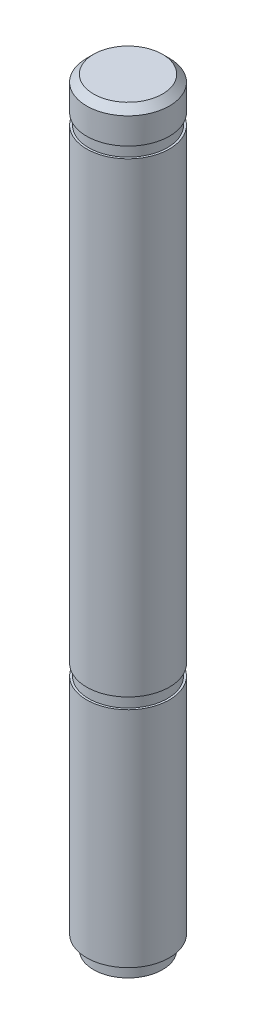
from build123d import *

# Parameters (mm, degrees)
SKETCH1_R           = 3
BOSS_EXTRUDE1_DEPTH = 40
CUT_EXTRUDE1_START  = 3.2
SKETCH2_R           = 3
SKETCH2_R_2         = 2.85
CUT_EXTRUDE1_DEPTH  = 0.8
CUT_EXTRUDE2_START  = -2.2
SKETCH3_R           = 3
SKETCH3_R_2         = 2.85
CUT_EXTRUDE2_DEPTH  = 0.8
CHAMFER1_SIZE       = 0.5
BOSS_EXTRUDE2_START = 15
SKETCH4_R           = 3
BOSS_EXTRUDE2_DEPTH = 15
SKETCH5_R           = 3
SKETCH5_R_2         = 2.5
CUT_EXTRUDE3_DEPTH  = 1


with BuildPart() as part:
    # Sketch1 → Boss-Extrude1 (new body)
    with BuildSketch(Plane(origin=(0, 0, 0), x_dir=(1, 0, 0), z_dir=(0, 1, 0))):
        with Locations(Location((0, 0, 0), (0, 0, 270))):
            Circle(SKETCH1_R)
    extrude(amount=BOSS_EXTRUDE1_DEPTH)

    # Sketch2 → Cut-Extrude1 (cut)
    with BuildSketch(Plane.XZ.offset(-40).offset(CUT_EXTRUDE1_START)):
        with Locations(Location((0, 0, 0), (0, 0, 270))):
            Circle(SKETCH2_R)
        with Locations(Location((0, 0, 0), (0, 0, 270))):
            Circle(SKETCH2_R_2, mode=Mode.SUBTRACT)
    extrude(amount=-CUT_EXTRUDE1_DEPTH, mode=Mode.SUBTRACT)

    # Sketch3 → Cut-Extrude2 (cut)
    with BuildSketch(Plane.XZ.offset(CUT_EXTRUDE2_START)):
        with Locations(Location((0, 0, 0), (0, 0, 270))):
            Circle(SKETCH3_R)
        with Locations(Location((0, 0, 0), (0, 0, 270))):
            Circle(SKETCH3_R_2, mode=Mode.SUBTRACT)
    extrude(amount=-CUT_EXTRUDE2_DEPTH, mode=Mode.SUBTRACT)

    # Chamfer1
    chamfer1_edges = [part.edges().sort_by_distance(p)[0] for p in [
        (0, 40, -3),
    ]]
    chamfer(chamfer1_edges, length=CHAMFER1_SIZE)

    # Sketch4 → Boss-Extrude2 (add)
    with BuildSketch(Plane.XZ.offset(BOSS_EXTRUDE2_START)):
        with Locations(Location((0, 0, 0), (0, 0, 270))):
            Circle(SKETCH4_R)
    extrude(amount=-BOSS_EXTRUDE2_DEPTH)

    # Sketch5 → Cut-Extrude3 (cut)
    with BuildSketch(Plane.XZ.offset(15)):
        with Locations(Location((0, 0, 0), (0, 0, 270))):
            Circle(SKETCH5_R)
        with Locations(Location((0, 0, 0), (0, 0, 270))):
            Circle(SKETCH5_R_2, mode=Mode.SUBTRACT)
    extrude(amount=-CUT_EXTRUDE3_DEPTH, mode=Mode.SUBTRACT)


solid = part.part
